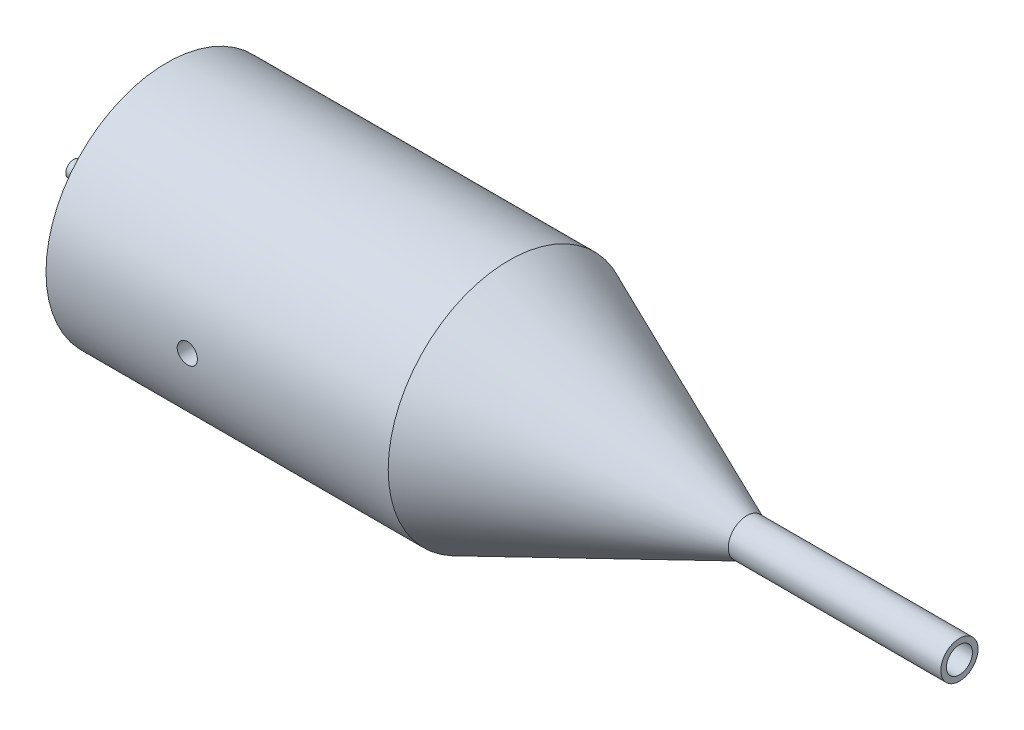
from build123d import *

# Parameters (mm, degrees)
ESBO_O2_R                = 2.1
RESSALTO_EXTRUS_O1_DEPTH = 14
ESBO_O3_R                = 10
RESSALTO_EXTRUS_O2_DEPTH = 5
ESBO_O4_R                = 3.50196924
CORTE_EXTRUS_O1_DEPTH    = 195
ESBO_O5_R                = 2.71004316
CORTE_EXTRUS_O2_DEPTH    = 45


with BuildPart() as part:
    # Esboço1 → Revolução1 (revolve)
    with BuildSketch(Plane.XY, mode=Mode.PRIVATE) as revolu_o1_sk:
        Polygon((9, 0), (9, -32.5), (101, -32.5), (164.919887291, -4.999614615), (222.073865158, -4.999614615), (222.073865158, 0), (164.919887291, 0), align=None)
    revolve(revolu_o1_sk.sketch.rotate(Axis((9, 0, 0), (1, 0, 0)), 270), axis=Axis((9, 0, 0), (1, 0, 0)))

    # Esboço2 → Ressalto-extrusão1 (add)
    with BuildSketch(Plane.ZY.offset(-9)):
        with Locations((0, 12.8)):
            Circle(ESBO_O2_R)
        with Locations((11.085125168, 6.4)):
            Circle(ESBO_O2_R)
        with Locations((11.085125168, -6.4)):
            Circle(ESBO_O2_R)
        with Locations((0, -12.8)):
            Circle(ESBO_O2_R)
        with Locations((-11.085125168, -6.4)):
            Circle(ESBO_O2_R)
        with Locations((-11.085125168, 6.4)):
            Circle(ESBO_O2_R)
    extrude(amount=RESSALTO_EXTRUS_O1_DEPTH)

    # Esboço3 → Ressalto-extrusão2 (add)
    with BuildSketch(Plane.ZY.offset(-9)):
        Circle(ESBO_O3_R)
    extrude(amount=RESSALTO_EXTRUS_O2_DEPTH)

    # Esboço4 → Corte-extrusão1 (cut)
    with BuildSketch(Plane(origin=(222.073865158, 0, 0), x_dir=(0, 0, -1), z_dir=(1, 0, 0))):
        Circle(ESBO_O4_R)
    extrude(amount=-CORTE_EXTRUS_O1_DEPTH, mode=Mode.SUBTRACT)

    # Esboço5 → Corte-extrusão2 (cut)
    with BuildSketch(Plane.XY):
        with Locations(Location((46.980237951, 0, 0), (0, 0, 180))):
            Circle(ESBO_O5_R)
    extrude(amount=CORTE_EXTRUS_O2_DEPTH, mode=Mode.SUBTRACT)


solid = part.part
